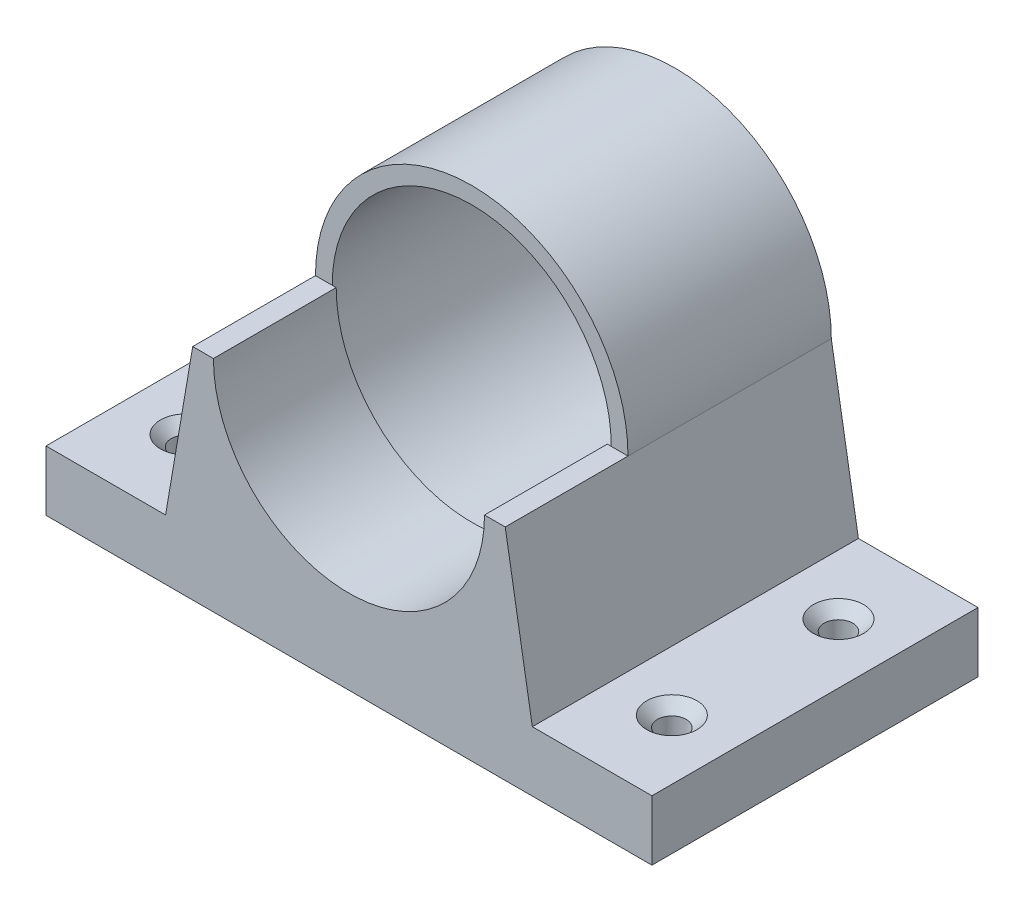
from build123d import *

# Parameters (mm, degrees)
SKETCH1_R                                       = 17.5
BOSS_EXTRUDE9_DEPTH                             = 25.5
BOSS_EXTRUDE10_DEPTH                            = 15.4
BOSS_EXTRUDE10_DEPTH_BACK                       = 25.5
CSK_FOR_M3_FLAT_HEAD_MACHINE_SCREW1_D           = 3.6
CSK_FOR_M3_FLAT_HEAD_MACHINE_SCREW1_CSINK_D     = 6.3
CSK_FOR_M3_FLAT_HEAD_MACHINE_SCREW1_CSINK_ANGLE = 90
CSK_FOR_M3_FLAT_HEAD_MACHINE_SCREW2_D           = 3.6
CSK_FOR_M3_FLAT_HEAD_MACHINE_SCREW2_CSINK_D     = 6.3
CSK_FOR_M3_FLAT_HEAD_MACHINE_SCREW2_CSINK_ANGLE = 90
BOSS_EXTRUDE11_DEPTH                            = 15.4
CUT_EXTRUDE3_REACH                              = 549.129
SKETCH17_R                                      = 1.8
SKETCH18_W                                      = 76
SKETCH18_H                                      = 40.9
BOSS_EXTRUDE12_DEPTH                            = 2.54


with BuildPart() as part:
    # Sketch1 → Boss-Extrude9 (new body)
    with BuildSketch(Plane.XY):
        with BuildLine():
            ThreePointArc((-19.6, 18.153395679), (0, 37.753395679), (19.6, 18.153395679))
            ThreePointArc((19.6, 18.153395679), (0, -1.446604321), (-19.6, 18.153395679))
        make_face()
        with Locations((0, 18.153395679)):
            Circle(SKETCH1_R, mode=Mode.SUBTRACT)
    extrude(amount=-BOSS_EXTRUDE9_DEPTH)

    # Sketch1<15> → Boss-Extrude10 (add, two sides: drawn at the far end of the back side and taken through both)
    with BuildSketch(Plane.XY.offset(-BOSS_EXTRUDE10_DEPTH_BACK)):
        with BuildLine():
            Line((-23, -1.846604321), (-38, -1.846604321))
            Line((-38, -1.846604321), (-38, -6.846604321))
            Line((-38, -6.846604321), (38, -6.846604321))
            Line((38, -6.846604321), (38, -1.846604321))
            Line((38, -1.846604321), (23, -1.846604321))
            Line((23, -1.846604321), (19.6, 18.153395679))
            ThreePointArc((19.6, 18.153395679), (0, -1.446604321), (-19.6, 18.153395679))
            Line((-19.6, 18.153395679), (-23, -1.846604321))
        make_face()
    extrude(amount=BOSS_EXTRUDE10_DEPTH + BOSS_EXTRUDE10_DEPTH_BACK)

    # CSK for M3 Flat Head Machine Screw1 (through all)
    with Locations(Plane(origin=(0, -1.846604321, 0), x_dir=(1, 0, 0), z_dir=(0, 1, 0))):
        with Locations((-30.5, 15.5), (-30.5, -5.4)):
            CounterSinkHole(CSK_FOR_M3_FLAT_HEAD_MACHINE_SCREW1_D / 2, CSK_FOR_M3_FLAT_HEAD_MACHINE_SCREW1_CSINK_D / 2, counter_sink_angle=CSK_FOR_M3_FLAT_HEAD_MACHINE_SCREW1_CSINK_ANGLE)

    # CSK for M3 Flat Head Machine Screw2 (through all)
    with Locations(Plane(origin=(0, -1.846604321, 0), x_dir=(1, 0, 0), z_dir=(0, 1, 0))):
        with Locations((30.5, -5.4), (30.5, 15.5)):
            CounterSinkHole(CSK_FOR_M3_FLAT_HEAD_MACHINE_SCREW2_D / 2, CSK_FOR_M3_FLAT_HEAD_MACHINE_SCREW2_CSINK_D / 2, counter_sink_angle=CSK_FOR_M3_FLAT_HEAD_MACHINE_SCREW2_CSINK_ANGLE)

    # Sketch1<19> → Boss-Extrude11 (add)
    with BuildSketch(Plane.XY):
        with BuildLine():
            ThreePointArc((-19.6, 18.153395679), (0, -1.446604321), (19.6, 18.153395679))
            Line((19.6, 18.153395679), (17, 18.153395679))
            ThreePointArc((17, 18.153395679), (0, 1.153395679), (-17, 18.153395679))
            Line((-17, 18.153395679), (-19.6, 18.153395679))
        make_face()
    extrude(amount=BOSS_EXTRUDE11_DEPTH)

    # Sketch17 → Cut-Extrude3 (cut, up to next)
    with BuildSketch(Plane(origin=(-499.24894984, 9.974554812, -84.308871479), x_dir=(0.050830850863694654, -0.0009181581696580717, 0.9987068546806156), z_dir=(0.0360908865319125, 0.9993480899541042, -0.0009181581696581681)), mode=Mode.PRIVATE) as cut_extrude3_sk1:
        with Locations((92.5, 462.5)):
            Circle(SKETCH17_R)
    cut_extrude3_tool1 = extrude(cut_extrude3_sk1.sketch, amount=-CUT_EXTRUDE3_REACH, mode=Mode.PRIVATE) & part.part
    # Sketch17 → Cut-Extrude3 (cut, up to next)
    with BuildSketch(Plane(origin=(-499.24894984, 9.974554812, -84.308871479), x_dir=(0.050830850863694654, -0.0009181581696580717, 0.9987068546806156), z_dir=(0.0360908865319125, 0.9993480899541042, -0.0009181581696581681)), mode=Mode.PRIVATE) as cut_extrude3_sk2:
        with Locations((113.4, 462.5)):
            Circle(SKETCH17_R)
    cut_extrude3_tool2 = extrude(cut_extrude3_sk2.sketch, amount=-CUT_EXTRUDE3_REACH, mode=Mode.PRIVATE) & part.part
    add(cut_extrude3_tool1.solids().sort_by_distance((-32.946684, -6.80241, -15.437756))[0], mode=Mode.SUBTRACT)
    add(cut_extrude3_tool2.solids().sort_by_distance((-31.884319, -6.821599, 5.435217))[0], mode=Mode.SUBTRACT)

    # Sketch18 → Boss-Extrude12 (add)
    with BuildSketch(Plane.XZ.offset(6.846604321)):
        with Locations((0, -5.05)):
            Rectangle(SKETCH18_W, SKETCH18_H)
    extrude(amount=BOSS_EXTRUDE12_DEPTH)


solid = part.part
